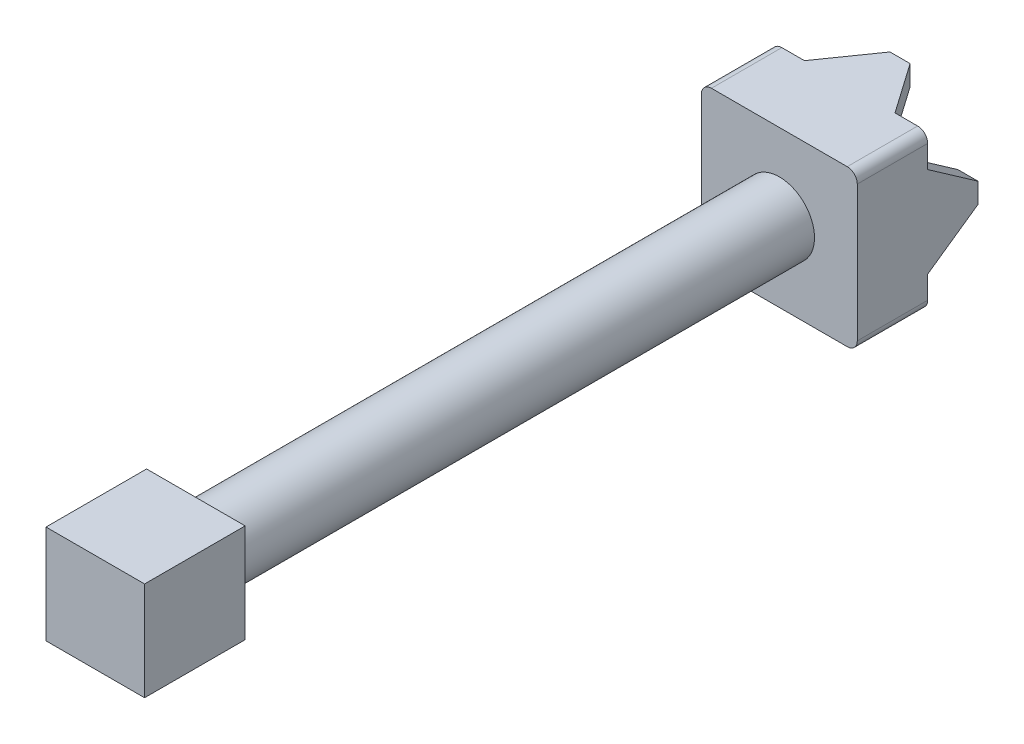
from build123d import *
from build123d.topology import SkipClean

# Parameters (mm, degrees)
SKETCH_1_W          = 9.5
SKETCH_1_H          = 9.5
EXTRUDE_2_DEPTH     = 5
FILLET_2_R          = 1
CUT_EXTRUDE_1_DEPTH = 34.132793262
EXTRUDE_3_DEPTH     = 5
EXTRUDE_5_DEPTH     = 2
EXTRUDE_6_DEPTH     = 2
EXTRUDE_7_DEPTH     = 2
EXTRUDE_8_DEPTH     = 2
EXTRUDE_START       = 2
EXTRUDE_10_DEPTH    = 2
SKETCH_15_R         = 3.5
EXTRUDE_11_DEPTH    = 58
SKETCH_16_W         = 9.8
SKETCH_16_H         = 9.8
EXTRUDE_12_DEPTH    = 10


with BuildPart() as part:
    # 草图1 → 凸台-拉伸2 (new body)
    with BuildSketch(Plane.XY):
        Polygon((-30.033755564, 13.067345411), (-14.533755564, 13.067345411), (-14.533755564, -2.432654589), (-30.033755564, -2.432654589), (-30.033755564, 10.067345411), align=None)
        with Locations((-22.283755564, 5.317345411)):
            Rectangle(SKETCH_1_W, SKETCH_1_H, mode=Mode.SUBTRACT)
    extrude(amount=EXTRUDE_2_DEPTH)

    # 圆角2
    fillet_2_edges = [part.edges().sort_by_distance(p)[0] for p in [
        (-30.033755564, 13.067345411, 2.5),
        (-14.533755564, 13.067345411, 2.5),
        (-14.533755564, -2.432654589, 2.5),
        (-30.033755564, -2.432654589, 2.5),
    ]]
    fillet(fillet_2_edges, radius=FILLET_2_R)

    # 草图2 → 切除-拉伸1 (cut, through all)
    with BuildSketch(Plane.XY.offset(5)):
        with BuildLine():
            ThreePointArc((-16.783755564, 5.317345411), (-16.974565419, 6.753486072), (-17.533755564, 8.089979537))
            Line((-17.533755564, 8.089979537), (-17.533755564, 2.544711284))
            ThreePointArc((-17.533755564, 2.544711284), (-16.974565419, 3.881204749), (-16.783755564, 5.317345411))
        make_face()
        with BuildLine():
            ThreePointArc((-19.511121437, 10.067345411), (-22.283755564, 10.817345411), (-25.056389691, 10.067345411))
            Line((-25.056389691, 10.067345411), (-22.283755564, 10.067345411))
            Line((-22.283755564, 10.067345411), (-19.511121437, 10.067345411))
        make_face()
        with BuildLine():
            Line((-27.033755564, 2.544711284), (-27.033755564, 8.089979537))
            ThreePointArc((-27.033755564, 8.089979537), (-27.783755564, 5.317345411), (-27.033755564, 2.544711284))
        make_face()
        with BuildLine():
            Line((-19.511121437, 0.567345411), (-22.283755564, 0.567345411))
            Line((-22.283755564, 0.567345411), (-25.056389691, 0.567345411))
            ThreePointArc((-25.056389691, 0.567345411), (-22.283755564, -0.182654589), (-19.511121437, 0.567345411))
        make_face()
    extrude(amount=-CUT_EXTRUDE_1_DEPTH, mode=Mode.SUBTRACT)

    # 草图4 → 凸台-拉伸3 (add)
    with SkipClean():  # the faces are left unmerged after this step: merging them gives an invalid solid
        with BuildSketch(Plane.XY.offset(5)):
            with BuildLine():
                Line((-25.056389691, 10.067345411), (-27.033755564, 10.067345411))
                Line((-27.033755564, 10.067345411), (-27.033755564, 8.089979537))
                ThreePointArc((-27.033755564, 8.089979537), (-26.17284286, 9.206432707), (-25.056389691, 10.067345411))
            make_face()
            with BuildLine():
                Line((-17.533755564, 10.067345411), (-19.511121437, 10.067345411))
                ThreePointArc((-19.511121437, 10.067345411), (-18.394668267, 9.206432707), (-17.533755564, 8.089979537))
                Line((-17.533755564, 8.089979537), (-17.533755564, 10.067345411))
            make_face()
            with BuildLine():
                Line((-17.533755564, 0.567345411), (-17.533755564, 2.544711284))
                ThreePointArc((-17.533755564, 2.544711284), (-18.394668267, 1.428258114), (-19.511121437, 0.567345411))
                Line((-19.511121437, 0.567345411), (-17.533755564, 0.567345411))
            make_face()
            with BuildLine():
                ThreePointArc((-25.056389691, 0.567345411), (-26.17284286, 1.428258114), (-27.033755564, 2.544711284))
                Line((-27.033755564, 2.544711284), (-27.033755564, 0.567345411))
                Line((-27.033755564, 0.567345411), (-25.056389691, 0.567345411))
            make_face()
        extrude(amount=-EXTRUDE_3_DEPTH)

    # 草图9 → 凸台-拉伸5 (add)
    with SkipClean():  # the faces are left unmerged after this step: merging them gives an invalid solid
        with BuildSketch(Plane.XZ.offset(2.432654589)):
            Polygon((-22.283755564, -5), (-22.283755564, 0), (-26.783755564, 0), (-23.283755564, -5), align=None)
            Polygon((-17.783755564, 0), (-22.283755564, 0), (-22.283755564, -5), (-21.283755564, -5), align=None)
        extrude(amount=-EXTRUDE_5_DEPTH)

    # 草图10 → 凸台-拉伸6 (add)
    with SkipClean():  # the faces are left unmerged after this step: merging them gives an invalid solid
        with BuildSketch(Plane(origin=(-14.533755564, 0, 0), x_dir=(0, 0, -1), z_dir=(1, 0, 0))):
            Polygon((5, 5.317345411), (0, 5.317345411), (0, 0.817345411), (5, 4.317345411), align=None)
            Polygon((0, 9.817345411), (0, 5.317345411), (5, 5.317345411), (5, 6.317345411), align=None)
        extrude(amount=-EXTRUDE_6_DEPTH)

    # 草图11 → 凸台-拉伸7 (add)
    with SkipClean():  # the faces are left unmerged after this step: merging them gives an invalid solid
        with BuildSketch(Plane.ZY.offset(30.033755564)):
            Polygon((0, 0.817345411), (0, 5.317345411), (-5, 5.317345411), (-5, 4.317345411), align=None)
            Polygon((-5, 5.317345411), (0, 5.317345411), (0, 9.817345411), (-5, 6.317345411), align=None)
        extrude(amount=-EXTRUDE_7_DEPTH)

    # 草图12 → 凸台-拉伸8 (add)
    with SkipClean():  # the faces are left unmerged after this step: merging them gives an invalid solid
        with BuildSketch(Plane(origin=(0, 13.067345411, 0), x_dir=(1, 0, 0), z_dir=(0, 1, 0))):
            Polygon((-26.783755564, 0), (-22.283755564, 0), (-22.283755564, 5), (-23.283755564, 5), align=None)
            Polygon((-22.283755564, 5), (-22.283755564, 0), (-17.783755564, 0), (-21.283755564, 5), align=None)
        extrude(amount=-EXTRUDE_8_DEPTH)

    # 草图13 → 凸台-拉伸10 (add)
    with SkipClean():  # the faces are left unmerged after this step: merging them gives an invalid solid
        with BuildSketch(Plane.XY.offset(5).offset(EXTRUDE_START)):
            with BuildLine():
                Line((-30.033755564, 12.067345411), (-30.033755564, -1.432654589))
                ThreePointArc((-30.033755564, -1.432654589), (-29.740862345, -2.13976137), (-29.033755564, -2.432654589))
                Line((-29.033755564, -2.432654589), (-15.533755564, -2.432654589))
                ThreePointArc((-15.533755564, -2.432654589), (-14.826648783, -2.13976137), (-14.533755564, -1.432654589))
                Line((-14.533755564, -1.432654589), (-14.533755564, 12.067345411))
                ThreePointArc((-14.533755564, 12.067345411), (-14.826648783, 12.774452192), (-15.533755564, 13.067345411))
                Line((-15.533755564, 13.067345411), (-29.033755564, 13.067345411))
                ThreePointArc((-29.033755564, 13.067345411), (-29.740862345, 12.774452192), (-30.033755564, 12.067345411))
            make_face()
        extrude(amount=-EXTRUDE_10_DEPTH)

    # 草图15 → 凸台-拉伸11 (add)
    with SkipClean():  # the faces are left unmerged after this step: merging them gives an invalid solid
        with BuildSketch(Plane.XY.offset(7)):
            with Locations(Location((-22.283755564, 5.317345411, 0), (0, 0, 180))):
                Circle(SKETCH_15_R)
        extrude(amount=EXTRUDE_11_DEPTH)

    # 草图16 → 凸台-拉伸12 (add)
    with SkipClean():  # the faces are left unmerged after this step: merging them gives an invalid solid
        with BuildSketch(Plane.XY.offset(65)):
            with Locations((-22.283755564, 5.317345411)):
                Rectangle(SKETCH_16_W, SKETCH_16_H)
        extrude(amount=EXTRUDE_12_DEPTH)


solid = part.part
